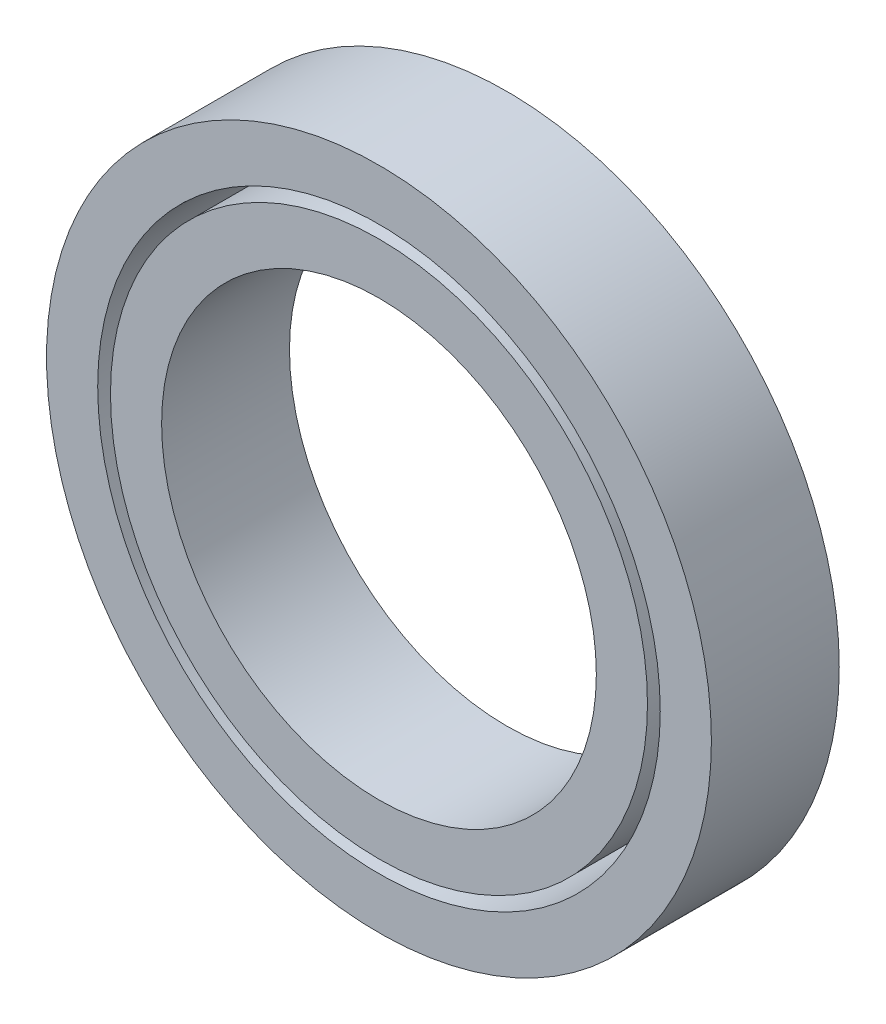
from build123d import *

# Parameters (mm, degrees)
ESQUISSE1_W = 2
ESQUISSE1_H = 5


with BuildPart() as part:
    # Esquisse1 → Révolution1 (revolve)
    with BuildSketch(Plane(origin=(0, 0, 0), x_dir=(1, 0, 0), z_dir=(0, 1, 0))):
        with Locations((9.5, 2.5)):
            Rectangle(ESQUISSE1_W, ESQUISSE1_H)
        with Locations((12, 2.5)):
            Rectangle(ESQUISSE1_W, ESQUISSE1_H)
    revolve(axis=Axis((0, 0, 6.622286364), (0, 0, -1)))


solid = part.part
